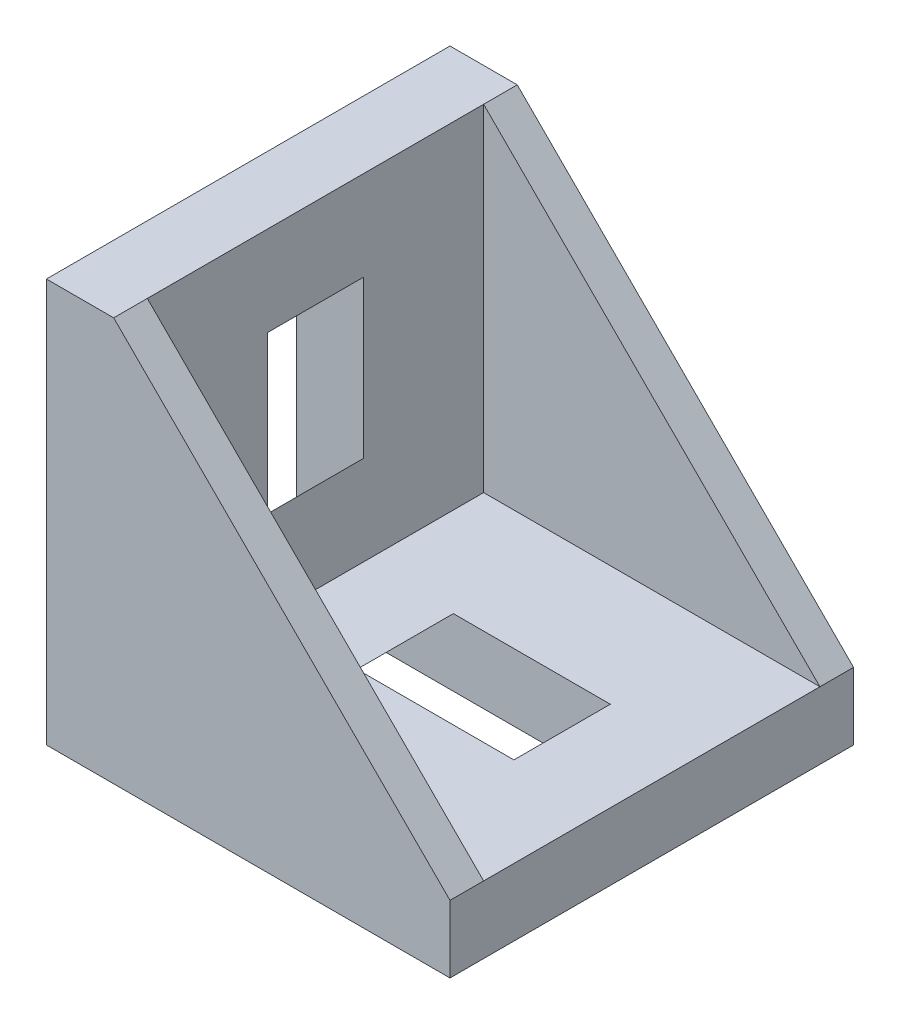
from build123d import *

# Parameters (mm, degrees)
BOSS_EXTRUDE1_DEPTH = 9
CUT_EXTRUDE1_DEPTH  = 7.5
CUT_EXTRUDE2_DEPTH  = 2.15
BOSS_EXTRUDE2_DEPTH = 2.5


with BuildPart() as part:
    # Sketch1 → Boss-Extrude1 (new, symmetric)
    with BuildSketch(Plane.XY):
        Polygon((0, 0), (0, 18), (3, 18), (18, 3), (18, 0), align=None)
    extrude(amount=BOSS_EXTRUDE1_DEPTH, both=True)

    # Sketch2 → Cut-Extrude1 (cut, symmetric)
    with BuildSketch(Plane.XY):
        Polygon((3, 18), (3, 3), (18, 3), align=None)
    extrude(amount=CUT_EXTRUDE1_DEPTH, both=True, mode=Mode.SUBTRACT)

    # Sketch3 → Cut-Extrude2 (cut, symmetric)
    with BuildSketch(Plane.XY):
        Polygon((0, 14), (3, 14), (3, 7), (0, 4), align=None)
        Polygon((7, 3), (14, 3), (14, 0), (4, 0), align=None)
    extrude(amount=CUT_EXTRUDE2_DEPTH, both=True, mode=Mode.SUBTRACT)

    # Sketch4 → Boss-Extrude2 (add, symmetric)
    with BuildSketch(Plane.XY):
        Polygon((1.504575227, -1.8), (0.511249685, -0.790946088), (1.234750477, 0), (3.535533906, 0), align=None)
        Polygon((0, 3.535533906), (-1.8, 1.504575227), (-0.790946088, 0.511249685), (0, 1.234750477), align=None)
        Polygon((0, 17.3), (0, 14.999216572), (-0.790946088, 14.275715779), (-1.8, 15.269041321), align=None)
        Polygon((14.999216572, 0), (14.275715779, -0.790946088), (15.269041321, -1.8), (17.3, 0), align=None)
    extrude(amount=BOSS_EXTRUDE2_DEPTH, both=True)


solid = part.part
